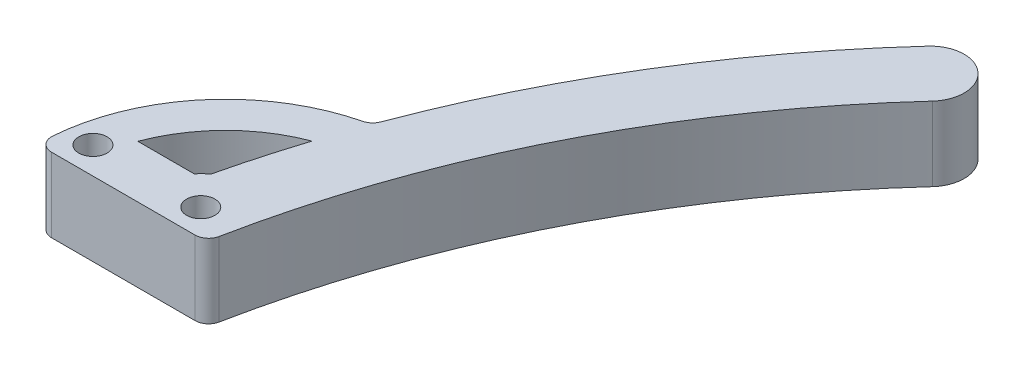
from build123d import *

# Parameters (mm, degrees)
SKETCH1_R           = 2.1
BOSS_EXTRUDE1_DEPTH = 11
FILLET1_R           = 2


with BuildPart() as part:
    # Sketch1 → Boss-Extrude1 (new body)
    with BuildSketch(Plane(origin=(0, 0, 0), x_dir=(1, 0, 0), z_dir=(0, 1, 0))):
        with BuildLine():
            Line((-169.316682473, 27), (-144.285495113, 27))
            ThreePointArc((-144.285495113, 27), (-131.38096704, 65.470188633), (-108.437297629, 98.937639869))
            ThreePointArc((-108.437297629, 98.937639869), (-108.760877497, 106.001300115), (-115.824537743, 105.677720247))
            ThreePointArc((-115.824537743, 105.677720247), (-133.944213048, 81.498784597), (-147.089597617, 54.293225847))
            ThreePointArc((-147.089597617, 54.293225847), (-163.056941322, 44.599456514), (-169.316682473, 27))
        make_face()
        with Locations(Location((-149.101129521, 31, 0), (0, 0, 270))):
            Circle(SKETCH1_R, mode=Mode.SUBTRACT)
        with Locations(Location((-165.101129521, 31, 0), (0, 0, 270))):
            Circle(SKETCH1_R, mode=Mode.SUBTRACT)
        with BuildLine():
            Line((-162.242742421, 34.797226479), (-153.870589387, 34.797226479))
            ThreePointArc((-153.870589387, 34.797226479), (-153.279814844, 35.43906131), (-152.603484102, 35.990008892))
            ThreePointArc((-152.603484102, 35.990008892), (-151.085722301, 41.907142789), (-149.338618997, 47.76066348))
            ThreePointArc((-149.338618997, 47.76066348), (-157.187118972, 42.668993907), (-162.242742421, 34.797226479))
        make_face(mode=Mode.SUBTRACT)
    extrude(amount=BOSS_EXTRUDE1_DEPTH)

    # Fillet1
    fillet1_edges = [part.edges().sort_by_distance(p)[0] for p in [
        (-147.089597617, 5.5, -54.293225847),
        (-144.285495113, 5.5, -27),
        (-169.316682473, 5.5, -27),
    ]]
    fillet(fillet1_edges, radius=FILLET1_R)


solid = part.part
